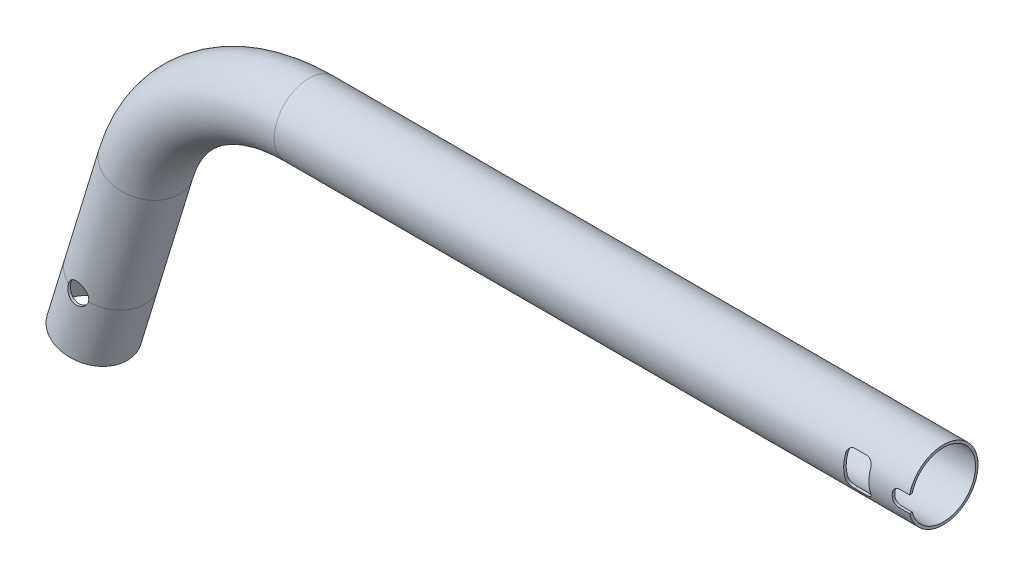
from build123d import *

# Parameters (mm, degrees)
SKETCH3_R          = 11
SKETCH3_R_2        = 10.2
CUT_EXTRUDE1_REACH = 197.895
SKETCH4_R          = 3.3
SKETCH5_R          = 3.3
CUT_EXTRUDE2_DEPTH = 196.894862351


with BuildPart() as part:
    # Sweep2: sweep along a path in Sketch1
    with BuildLine(Plane.XY) as sweep2_path:
        Line((108.839588828, 0), (92.239588828, 0))
        Line((92.239588828, 0), (-92.239588828, 0))
        ThreePointArc((-92.239588828, 0), (-124.360019313, -10.591729527), (-143.88004565, -38.211927945))
        Line((-143.88004565, -38.211927945), (-154.760411172, -73.8))
        Line((-154.760411172, -73.8), (-160.324709574, -92))
    # Sketch3 → Sweep2 (sweep)
    with BuildSketch(Plane(origin=(92.239588828, 0, 0), x_dir=(0, 0, -1), z_dir=(1, 0, 0))):
        Circle(SKETCH3_R)
        Circle(SKETCH3_R_2, mode=Mode.SUBTRACT)
    sweep(path=sweep2_path.line)

    # Sketch4 → Cut-Extrude1 (cut, up to next)
    with BuildSketch(Plane.XY, mode=Mode.PRIVATE) as cut_extrude1_sk1:
        with Locations((-154.760411172, -73.8)):
            Circle(SKETCH4_R)
    cut_extrude1_tool1 = extrude(cut_extrude1_sk1.sketch, amount=CUT_EXTRUDE1_REACH, mode=Mode.PRIVATE) & part.part
    # Sketch4 → Cut-Extrude1 (cut, up to next)
    with BuildSketch(Plane.XY, mode=Mode.PRIVATE) as cut_extrude1_sk2:
        with BuildLine():
            Line((108.839588828, 2.555545653), (108.839588828, -2.555545653))
            Line((108.839588828, -2.555545653), (105.639588828, -2.555545653))
            ThreePointArc((105.639588828, -2.555545653), (104.225375266, -1.969759216), (103.639588828, -0.555545653))
            Line((103.639588828, -0.555545653), (103.639588828, 0.555545653))
            ThreePointArc((103.639588828, 0.555545653), (104.225375266, 1.969759216), (105.639588828, 2.555545653))
            Line((105.639588828, 2.555545653), (108.839588828, 2.555545653))
        make_face()
    cut_extrude1_tool2 = extrude(cut_extrude1_sk2.sketch, amount=CUT_EXTRUDE1_REACH, mode=Mode.PRIVATE) & part.part
    # Sketch4 → Cut-Extrude1 (cut, up to next)
    with BuildSketch(Plane.XY, mode=Mode.PRIVATE) as cut_extrude1_sk3:
        with BuildLine():
            Line((90.239588828, -5.5), (94.239588828, -5.5))
            ThreePointArc((94.239588828, -5.5), (95.653802391, -4.914213562), (96.239588828, -3.5))
            Line((96.239588828, -3.5), (96.239588828, 3.5))
            ThreePointArc((96.239588828, 3.5), (95.653802391, 4.914213562), (94.239588828, 5.5))
            Line((94.239588828, 5.5), (90.239588828, 5.5))
            ThreePointArc((90.239588828, 5.5), (88.825375266, 4.914213562), (88.239588828, 3.5))
            Line((88.239588828, 3.5), (88.239588828, -3.5))
            ThreePointArc((88.239588828, -3.5), (88.825375266, -4.914213562), (90.239588828, -5.5))
        make_face()
    cut_extrude1_tool3 = extrude(cut_extrude1_sk3.sketch, amount=CUT_EXTRUDE1_REACH, mode=Mode.PRIVATE) & part.part
    add(cut_extrude1_tool1.solids().sort_by_distance((-154.760411, -73.8, 0))[0], mode=Mode.SUBTRACT)
    add(cut_extrude1_tool2.solids().sort_by_distance((106.388287, 0, 0))[0], mode=Mode.SUBTRACT)
    add(cut_extrude1_tool3.solids().sort_by_distance((92.239589, 0, 0))[0], mode=Mode.SUBTRACT)

    # Sketch5 → Cut-Extrude2 (cut, through all)
    with BuildSketch(Plane.XY):
        with Locations((-154.760411172, -73.8)):
            Circle(SKETCH5_R)
    extrude(amount=-CUT_EXTRUDE2_DEPTH, mode=Mode.SUBTRACT)


solid = part.part
